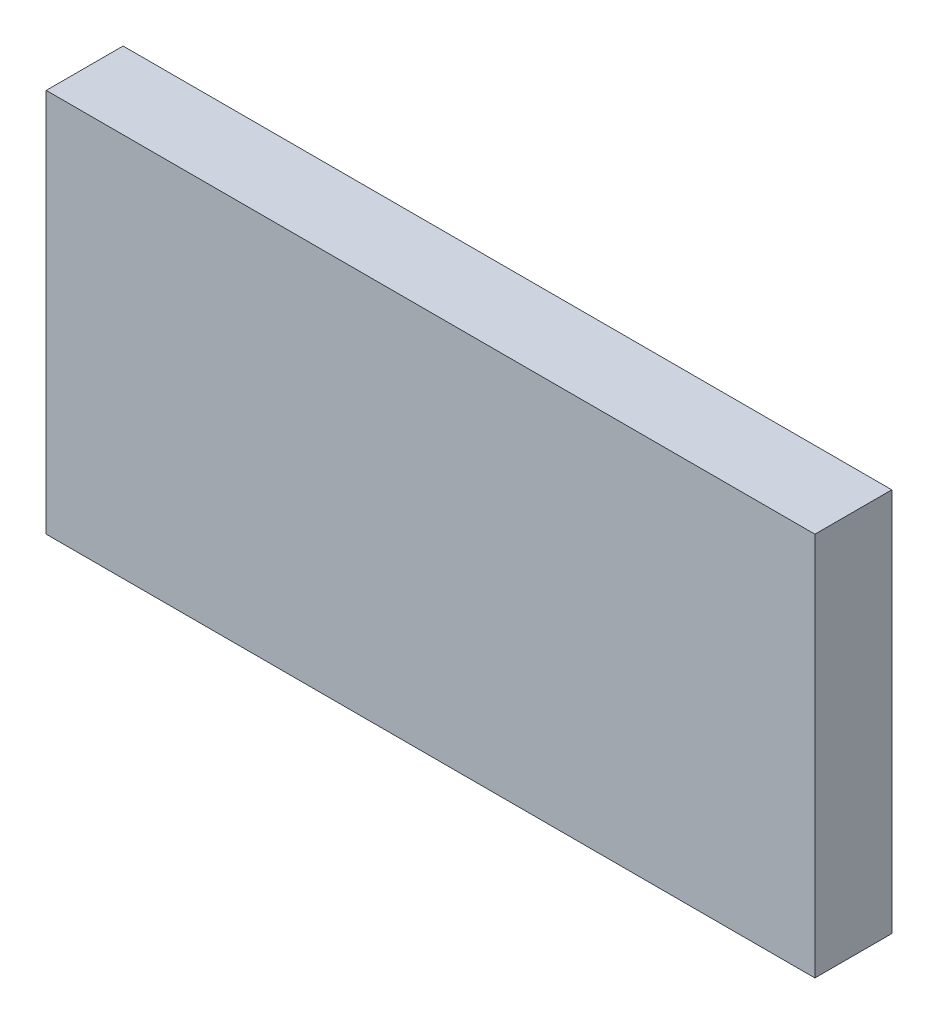
from build123d import *

# Parameters (mm, degrees)
SKETCH1_W           = 40
SKETCH1_H           = 20
BOSS_EXTRUDE1_DEPTH = 4


with BuildPart() as part:
    # Sketch1 → Boss-Extrude1 (new body)
    with BuildSketch(Plane.XY):
        with Locations((20, 10)):
            Rectangle(SKETCH1_W, SKETCH1_H)
    extrude(amount=BOSS_EXTRUDE1_DEPTH)


solid = part.part
